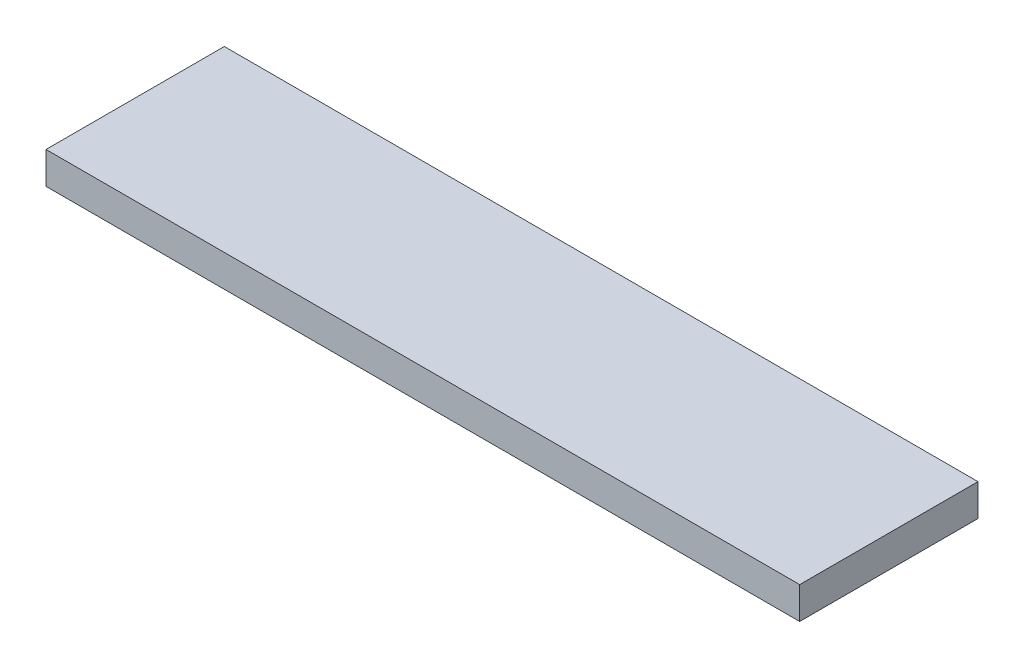
from build123d import *

# Parameters (mm, degrees)
SKETCH_1_W      = 224
SKETCH_1_H      = 53
EXTRUDE_1_DEPTH = 9.5


with BuildPart() as part:
    # 草图1 → 凸台-拉伸1 (new body)
    with BuildSketch(Plane(origin=(0, 0, 0), x_dir=(1, 0, 0), z_dir=(0, 1, 0))):
        with Locations((112, -26.5)):
            Rectangle(SKETCH_1_W, SKETCH_1_H)
    extrude(amount=EXTRUDE_1_DEPTH)


solid = part.part
